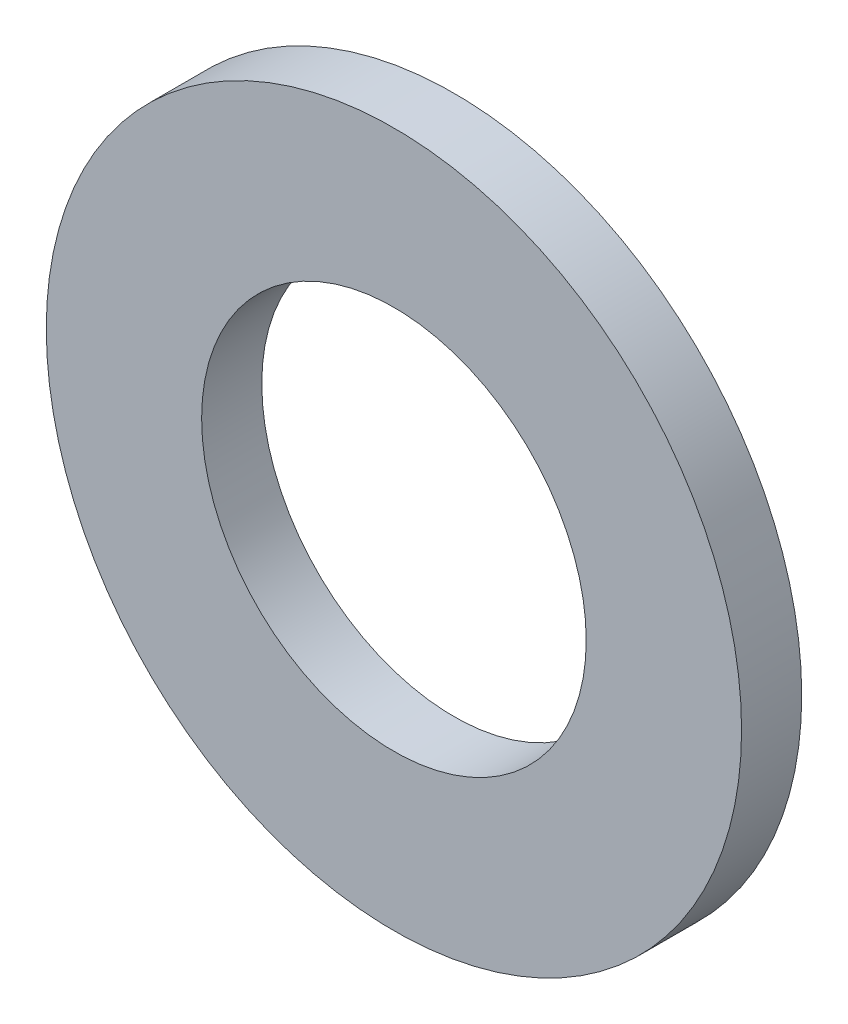
from build123d import *

# Parameters (mm, degrees)
BOSS_EXTRUDE1_DEPTH      = 0.80645
BOSS_EXTRUDE1_DEPTH_BACK = 0.80645
SKETCH3_R                = 9.3218
SKETCH3_R_2              = 5.1562


with BuildPart() as part:
    # Sketch3 → Boss-Extrude1 (new, two sides: drawn at the far end of the back side and taken through both)
    with BuildSketch(Plane.XY.offset(-BOSS_EXTRUDE1_DEPTH_BACK)):
        Circle(SKETCH3_R)
        Circle(SKETCH3_R_2, mode=Mode.SUBTRACT)
    extrude(amount=BOSS_EXTRUDE1_DEPTH + BOSS_EXTRUDE1_DEPTH_BACK)


solid = part.part
